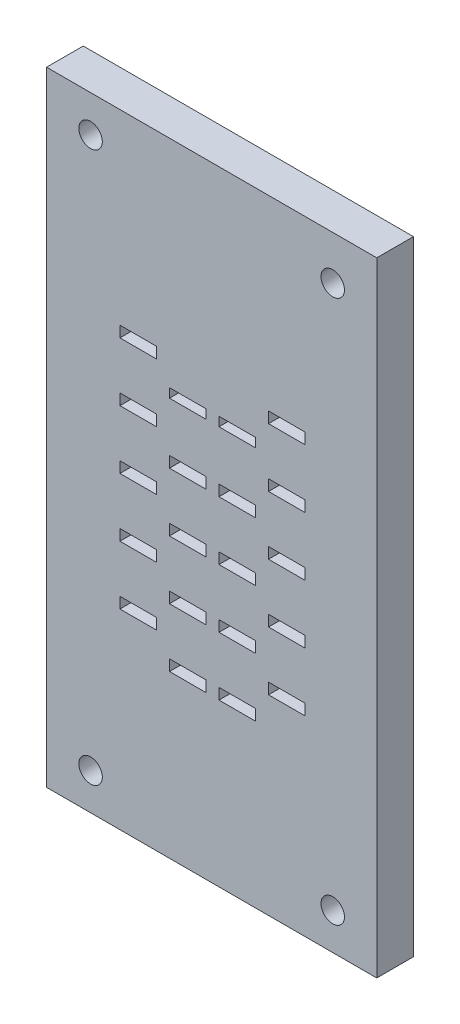
from build123d import *

# Parameters (mm, degrees)
SKIZZE1_W                       = 45
SKIZZE1_H                       = 85
AUFSATZ_LINEAR_AUSTRAGEN1_DEPTH = 5
SKIZZE3_W                       = 5
SKIZZE3_H                       = 1.5
SKIZZE3_H_2                     = 1.241942413
SCHNITT_LINEAR_AUSTRAGEN1_DEPTH = 5
SKIZZE4_R                       = 1.6
SCHNITT_LINEAR_AUSTRAGEN2_DEPTH = 5


with BuildPart() as part:
    # Skizze1 → Aufsatz-Linear austragen1 (new body)
    with BuildSketch(Plane.XY):
        with Locations((22.5, 42.5)):
            Rectangle(SKIZZE1_W, SKIZZE1_H)
    extrude(amount=AUFSATZ_LINEAR_AUSTRAGEN1_DEPTH)

    # Skizze3 → Schnitt-Linear austragen1 (cut)
    with BuildSketch(Plane.XY.offset(5)):
        with Locations((12.5, 58.8)):
            Rectangle(SKIZZE3_W, SKIZZE3_H)
        with Locations((32.75, 58.8)):
            Rectangle(SKIZZE3_W, SKIZZE3_H)
        with Locations((19.25, 46.8)):
            Rectangle(SKIZZE3_W, SKIZZE3_H)
        with Locations((12.5, 50.8)):
            Rectangle(SKIZZE3_W, SKIZZE3_H)
        with Locations((32.75, 50.8)):
            Rectangle(SKIZZE3_W, SKIZZE3_H)
        with Locations((12.5, 42.8)):
            Rectangle(SKIZZE3_W, SKIZZE3_H)
        with Locations((32.75, 42.8)):
            Rectangle(SKIZZE3_W, SKIZZE3_H)
        with Locations((12.5, 34.8)):
            Rectangle(SKIZZE3_W, SKIZZE3_H)
        with Locations((32.75, 34.8)):
            Rectangle(SKIZZE3_W, SKIZZE3_H)
        with Locations((32.75, 26.8)):
            Rectangle(SKIZZE3_W, SKIZZE3_H)
        with Locations((12.5, 26.8)):
            Rectangle(SKIZZE3_W, SKIZZE3_H)
        with Locations((19.25, 54.929028794)):
            Rectangle(SKIZZE3_W, SKIZZE3_H_2)
        with Locations((26, 54.929028794)):
            Rectangle(SKIZZE3_W, SKIZZE3_H_2)
        with Locations((26, 46.8)):
            Rectangle(SKIZZE3_W, SKIZZE3_H)
        with Locations((26, 38.8)):
            Rectangle(SKIZZE3_W, SKIZZE3_H)
        with Locations((19.25, 38.8)):
            Rectangle(SKIZZE3_W, SKIZZE3_H)
        with Locations((19.25, 30.8)):
            Rectangle(SKIZZE3_W, SKIZZE3_H)
        with Locations((26, 30.8)):
            Rectangle(SKIZZE3_W, SKIZZE3_H)
        with Locations((26, 22.8)):
            Rectangle(SKIZZE3_W, SKIZZE3_H)
        with Locations((19.25, 22.8)):
            Rectangle(SKIZZE3_W, SKIZZE3_H)
    extrude(amount=-SCHNITT_LINEAR_AUSTRAGEN1_DEPTH, mode=Mode.SUBTRACT)

    # Skizze4 → Schnitt-Linear austragen2 (cut)
    with BuildSketch(Plane.XY.offset(5)):
        with Locations((6, 80)):
            Circle(SKIZZE4_R)
        with Locations((39, 79)):
            Circle(SKIZZE4_R)
        with Locations((39, 5)):
            Circle(SKIZZE4_R)
        with Locations((6, 5)):
            Circle(SKIZZE4_R)
    extrude(amount=-SCHNITT_LINEAR_AUSTRAGEN2_DEPTH, mode=Mode.SUBTRACT)


solid = part.part
